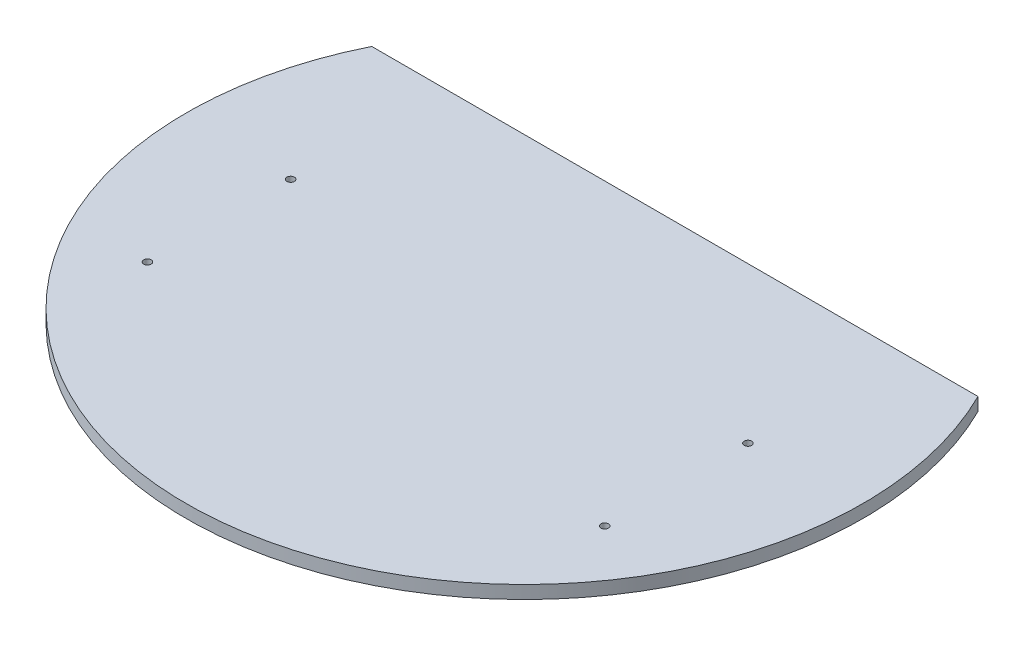
from build123d import *

# Parameters (mm, degrees)
SKETCH1_R             = 164.975
BOSS_EXTRUDE1_DEPTH   = 6.35
F_6_CLEARANCE_HOLE1_D = 3.6576
CUT_EXTRUDE1_START    = -6.35
CUT_EXTRUDE1_DEPTH    = 6.35


with BuildPart() as part:
    # Sketch1 → Boss-Extrude1 (new body)
    with BuildSketch(Plane(origin=(0, 0, 0), x_dir=(1, 0, 0), z_dir=(0, 1, 0))):
        with Locations(Location((0, 0, 0), (0, 0, 270))):
            Circle(SKETCH1_R)
    extrude(amount=BOSS_EXTRUDE1_DEPTH)

    # #6 Clearance Hole1 (through all)
    with Locations(Plane(origin=(111.465, 0, 2.54), x_dir=(0, 0, -1), z_dir=(0, -1, 0))):
        with Locations((0, 0), (-69.85, 0), (-69.85, -222.93), (0, -222.93)):
            Hole(F_6_CLEARANCE_HOLE1_D / 2)

    # Sketch9 → Cut-Extrude1 (cut)
    with BuildSketch(Plane(origin=(0, 6.35, 0), x_dir=(1, 0, 0), z_dir=(0, 1, 0)).offset(CUT_EXTRUDE1_START)):
        with BuildLine():
            Line((-147.793016902, 73.307399216), (147.793016902, 73.307399216))
            ThreePointArc((147.793016902, 73.307399216), (0, 164.975), (-147.793016902, 73.307399216))
        make_face()
    extrude(amount=CUT_EXTRUDE1_DEPTH, mode=Mode.SUBTRACT)


solid = part.part
